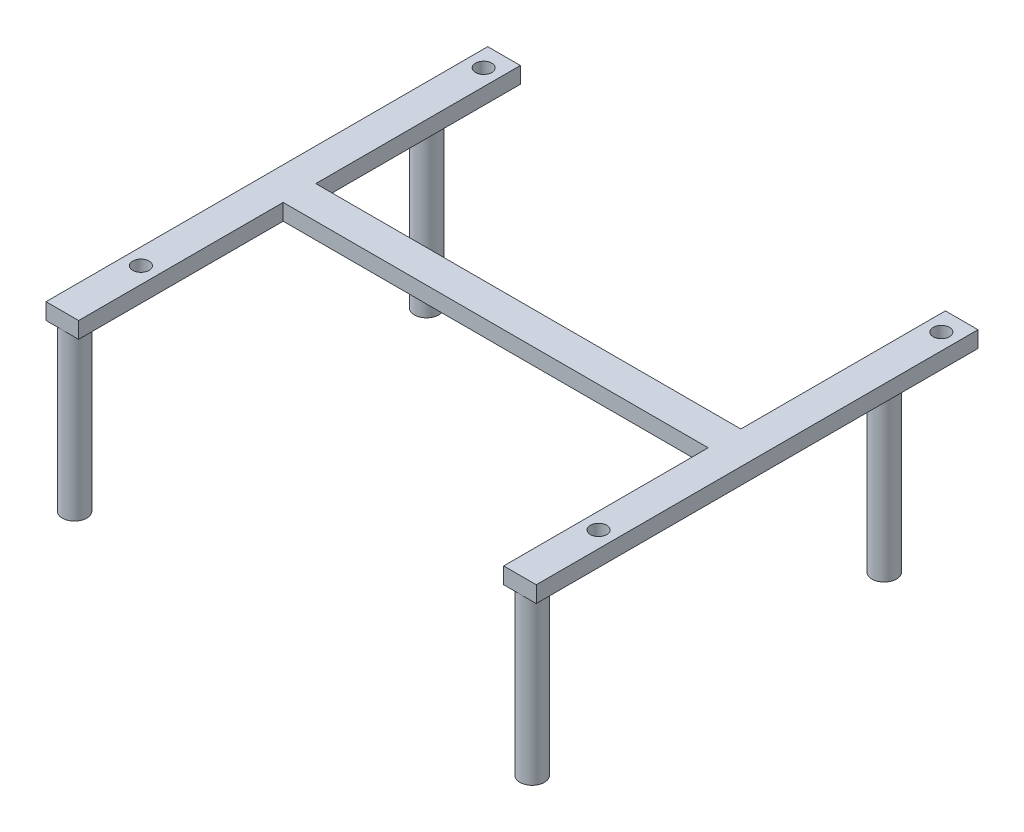
from build123d import *

# Parameters (mm, degrees)
SKETCH_1_R          = 1.5
EXTRUDE_1_DEPTH     = 20
EXTRUDE_1_2_DEPTH   = 20
EXTRUDE_1_3_DEPTH   = 20
EXTRUDE_1_4_DEPTH   = 20
EXTRUDE_2_DEPTH     = 2
SKETCH_4_R          = 1
CUT_EXTRUDE_1_DEPTH = 2


with BuildPart() as part:
    # 草图1 → 凸台-拉伸1 (new body)
    with BuildSketch(Plane(origin=(0, 0, 0), x_dir=(1, 0, 0), z_dir=(0, 1, 0))):
        with Locations(Location((0, 0, 0), (0, 0, 270))):
            Circle(SKETCH_1_R)
    extrude(amount=EXTRUDE_1_DEPTH)



with BuildPart() as body_2:
    # 草图1 → Extrude 1 2 (new body)
    with BuildSketch(Plane(origin=(0, 0, 0), x_dir=(1, 0, 0), z_dir=(0, 1, 0))):
        with Locations(Location((0, 43.18, 0), (0, 0, 270))):
            Circle(SKETCH_1_R)
    extrude(amount=EXTRUDE_1_2_DEPTH)


with BuildPart() as body_3:
    # 草图1 → Extrude 1 3 (new body)
    with BuildSketch(Plane(origin=(0, 0, 0), x_dir=(1, 0, 0), z_dir=(0, 1, 0))):
        with Locations(Location((56.13, 43.18, 0), (0, 0, 270))):
            Circle(SKETCH_1_R)
    extrude(amount=EXTRUDE_1_3_DEPTH)


with BuildPart() as body_4:
    # 草图1 → Extrude 1 4 (new body)
    with BuildSketch(Plane(origin=(0, 0, 0), x_dir=(1, 0, 0), z_dir=(0, 1, 0))):
        with Locations(Location((56.13, 0, 0), (0, 0, 270))):
            Circle(SKETCH_1_R)
    extrude(amount=EXTRUDE_1_4_DEPTH)


with BuildPart() as part_1:
    add(part.part)

    add(body_2.part)  # 凸台-拉伸2 merges body 2
    # 草图2 → 凸台-拉伸2 (add)
    with BuildSketch(Plane(origin=(0, 20, 0), x_dir=(1, 0, 0), z_dir=(0, 1, 0))):
        Polygon((-2, 52.68), (-2, -1.5), (2, -1.5), (2, 23.59), (54.13, 23.59), (54.13, -1.5), (58.13, -1.5), (58.13, 52.68), (54.13, 52.68), (54.13, 27.59), (2, 27.59), (2, 52.68), align=None)
    extrude(amount=EXTRUDE_2_DEPTH)

    # 草图4 → 切除-拉伸1 (cut)
    with BuildSketch(Plane(origin=(0, 22, 0), x_dir=(1, 0, 0), z_dir=(0, 1, 0))):
        with Locations(Location((0, 50.18, 0), (0, 0, 270))):
            Circle(SKETCH_4_R)
        with Locations(Location((0, 8.143, 0), (0, 0, 270))):
            Circle(SKETCH_4_R)
        with Locations(Location((56.13, 8.143, 0), (0, 0, 270))):
            Circle(SKETCH_4_R)
        with Locations(Location((56.13, 50.18, 0), (0, 0, 270))):
            Circle(SKETCH_4_R)
    extrude(amount=-CUT_EXTRUDE_1_DEPTH, mode=Mode.SUBTRACT)


solid = Compound([body_3.part, body_4.part, part_1.part])
